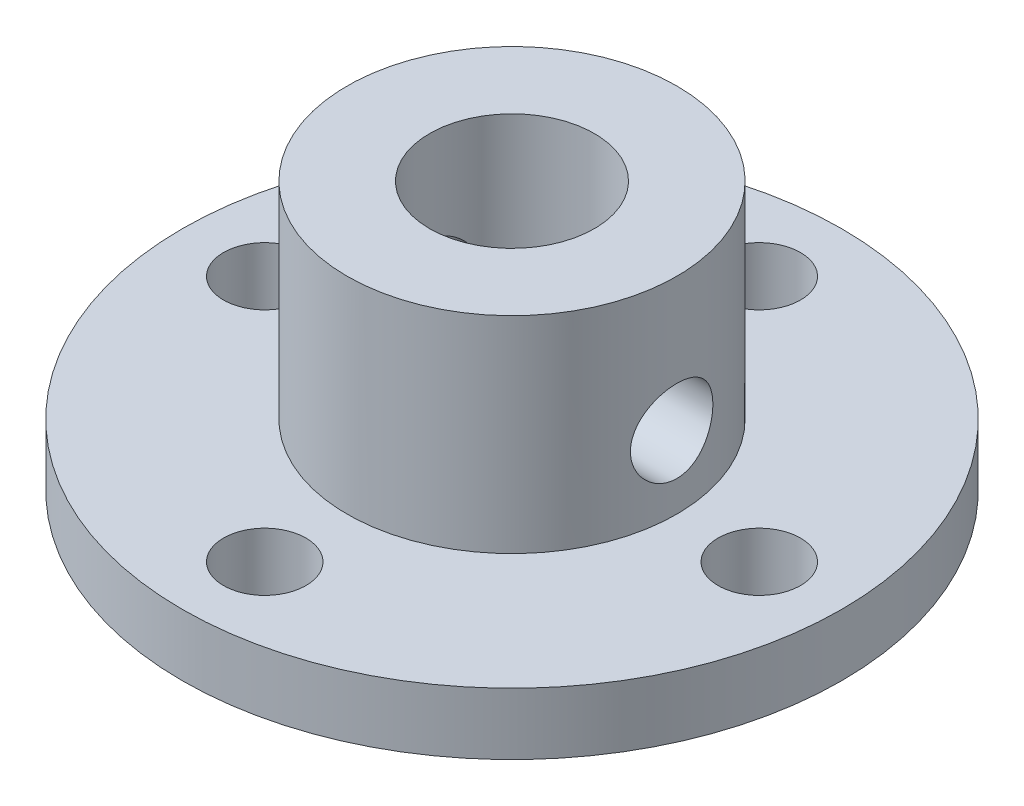
from build123d import *

# Parameters (mm, degrees)
SKETCH1_R               = 8
SKETCH1_R_2             = 4
BOSS_EXTRUDE1_DEPTH     = 13
SKETCH2_R               = 16
SKETCH2_R_2             = 4
SKETCH2_R_3             = 2
BOSS_EXTRUDE2_DEPTH     = 3
CUT_EXTRUDE1_DEPTH      = 11
CUT_EXTRUDE1_DEPTH_BACK = 14
SKETCH5_R               = 2


with BuildPart() as part:
    # Sketch1 → Boss-Extrude1 (new body)
    with BuildSketch(Plane(origin=(0, 0, 0), x_dir=(1, 0, 0), z_dir=(0, 1, 0))):
        with Locations(Location((0, 0, 0), (0, 0, 90))):
            Circle(SKETCH1_R)
        with Locations(Location((0, 0, 0), (0, 0, 90))):
            Circle(SKETCH1_R_2, mode=Mode.SUBTRACT)
    extrude(amount=BOSS_EXTRUDE1_DEPTH)

    # Sketch2 → Boss-Extrude2 (add)
    with BuildSketch(Plane.XZ):
        with Locations(Location((0, 0, 0), (0, 0, 270))):
            Circle(SKETCH2_R)
        with Locations(Location((0, 0, 0), (0, 0, 270))):
            Circle(SKETCH2_R_2, mode=Mode.SUBTRACT)
        with Locations(Location((0, 12, 0), (0, 0, 270))):
            Circle(SKETCH2_R_3, mode=Mode.SUBTRACT)
        with Locations(Location((12, 0, 0), (0, 0, 270))):
            Circle(SKETCH2_R_3, mode=Mode.SUBTRACT)
        with Locations(Location((0, -12, 0), (0, 0, 270))):
            Circle(SKETCH2_R_3, mode=Mode.SUBTRACT)
        with Locations(Location((-12, 0, 0), (0, 0, 270))):
            Circle(SKETCH2_R_3, mode=Mode.SUBTRACT)
    extrude(amount=-BOSS_EXTRUDE2_DEPTH)

    # Sketch5 → Cut-Extrude1 (cut, two sides: drawn at the far end of the back side and taken through both)
    with BuildSketch(Plane.ZY.offset(-CUT_EXTRUDE1_DEPTH_BACK)):
        with Locations(Location((0, 6.5, 0), (0, 0, 180))):
            Circle(SKETCH5_R)
    extrude(amount=CUT_EXTRUDE1_DEPTH + CUT_EXTRUDE1_DEPTH_BACK, mode=Mode.SUBTRACT)


solid = part.part
